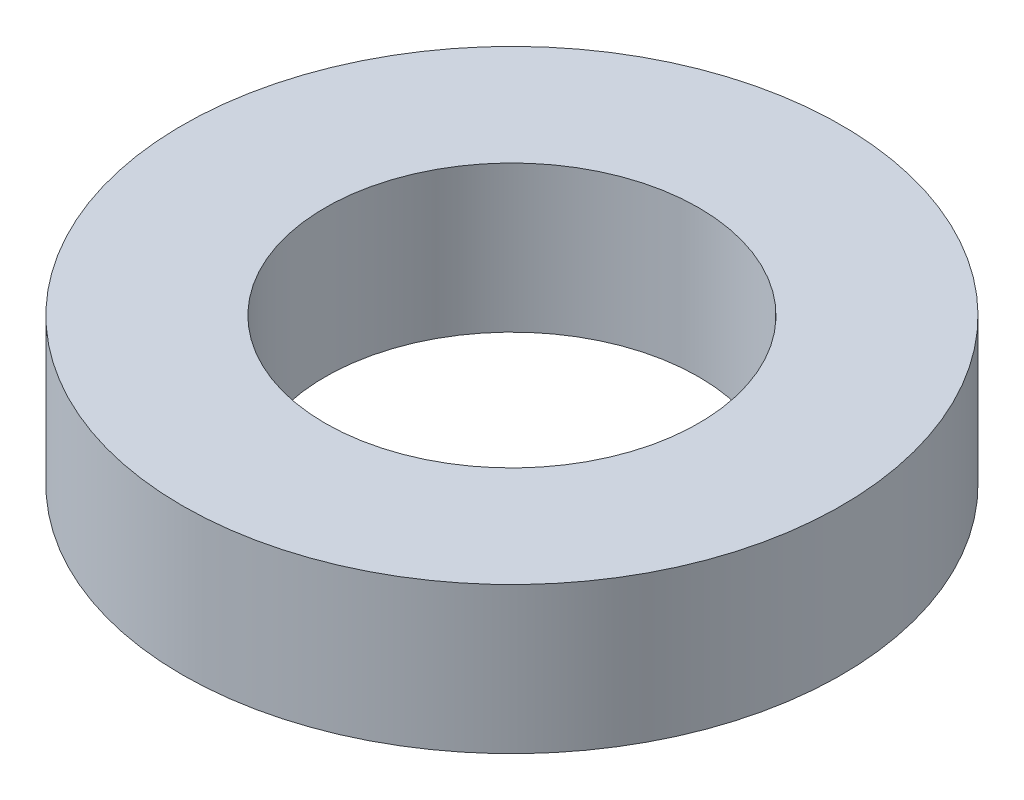
from build123d import *

# Parameters (mm, degrees)
SKETCH3_R           = 4.5
SKETCH3_R_2         = 2.55
BOSS_EXTRUDE1_DEPTH = 2


with BuildPart() as part:
    # Sketch3 → Boss-Extrude1 (new body)
    with BuildSketch(Plane(origin=(0, 0, 0), x_dir=(1, 0, 0), z_dir=(0, 1, 0))):
        with Locations(Location((0, 0, 0), (0, 0, 270))):
            Circle(SKETCH3_R)
        with Locations(Location((0, 0, 0), (0, 0, 270))):
            Circle(SKETCH3_R_2, mode=Mode.SUBTRACT)
    extrude(amount=BOSS_EXTRUDE1_DEPTH)


solid = part.part
